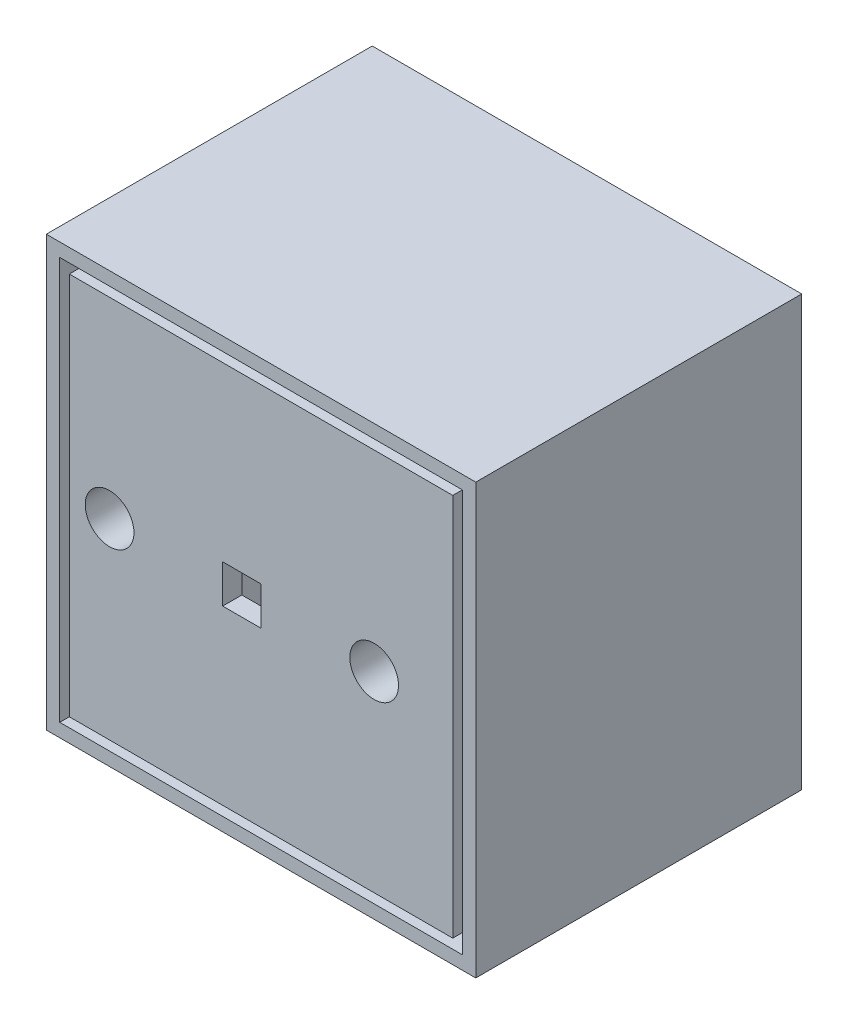
from build123d import *

# Parameters (mm, degrees)
SKETCH2_W           = 112
SKETCH2_H           = 112
SKETCH2_W_2         = 10
SKETCH2_H_2         = 10
BOSS_EXTRUDE1_DEPTH = 5
SKETCH3_W           = 112
SKETCH3_H           = 112
SKETCH3_W_2         = 105
SKETCH3_H_2         = 105
SKETCH3_W_3         = 100
SKETCH3_H_3         = 100
SKETCH3_R           = 6.35
SKETCH3_W_4         = 10
SKETCH3_H_4         = 10
BOSS_EXTRUDE2_DEPTH = 20
SKETCH4_W           = 50
SKETCH4_H           = 50
CUT_EXTRUDE1_DEPTH  = 20
SKETCH8_W           = 112
SKETCH8_H           = 112
SKETCH8_W_2         = 100
SKETCH8_H_2         = 100
BOSS_EXTRUDE3_DEPTH = 60


with BuildPart() as part:
    # Sketch2 → Boss-Extrude1 (new body)
    with BuildSketch(Plane.XY):
        Rectangle(SKETCH2_W, SKETCH2_H)
        with Locations((-5, 0)):
            Rectangle(SKETCH2_W_2, SKETCH2_H_2, mode=Mode.SUBTRACT)
    extrude(amount=BOSS_EXTRUDE1_DEPTH)

    # Sketch3 → Boss-Extrude2 (add)
    # profile 1 of 2: a face of its own
    with BuildSketch(Plane.XY.offset(5)):
        Rectangle(SKETCH3_W, SKETCH3_H)
        Rectangle(SKETCH3_W_2, SKETCH3_H_2, mode=Mode.SUBTRACT)
    # profile 2 of 2: a face of its own
    with BuildSketch(Plane.XY.offset(5)):
        Rectangle(SKETCH3_W_3, SKETCH3_H_3)
        with Locations((-39.5, 0)):
            Circle(SKETCH3_R, mode=Mode.SUBTRACT)
        with Locations((-5, 0)):
            Rectangle(SKETCH3_W_4, SKETCH3_H_4, mode=Mode.SUBTRACT)
        with Locations((29.5, 0)):
            Circle(SKETCH3_R, mode=Mode.SUBTRACT)
    extrude(amount=BOSS_EXTRUDE2_DEPTH)

    # Sketch4 → Cut-Extrude1 (cut)
    with BuildSketch(Plane(origin=(0, 0, 0), x_dir=(-1, 0, 0), z_dir=(0, 0, -1))):
        with Locations((5, 0)):
            Rectangle(SKETCH4_W, SKETCH4_H)
    extrude(amount=-CUT_EXTRUDE1_DEPTH, mode=Mode.SUBTRACT)

    # Sketch8 → Boss-Extrude3 (add)
    with BuildSketch(Plane(origin=(0, 0, 0), x_dir=(-1, 0, 0), z_dir=(0, 0, -1))):
        Rectangle(SKETCH8_W, SKETCH8_H)
        Rectangle(SKETCH8_W_2, SKETCH8_H_2, mode=Mode.SUBTRACT)
    extrude(amount=BOSS_EXTRUDE3_DEPTH)


solid = part.part
